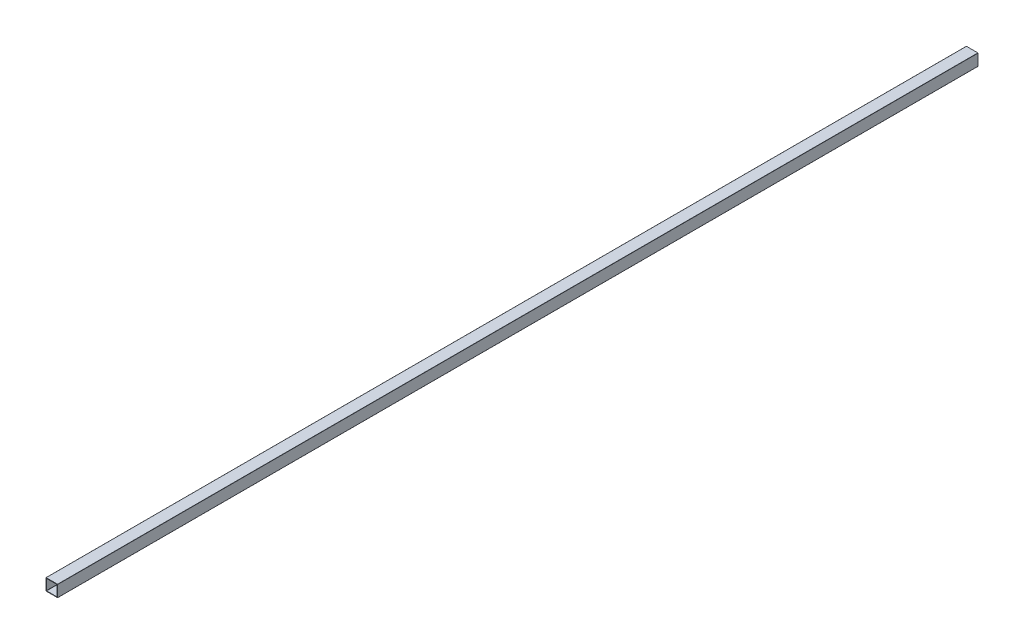
from build123d import *

# Parameters (mm, degrees)
CROQUIS1_W              = 76.2
CROQUIS1_H              = 76.2
CROQUIS1_W_2            = 70.12
CROQUIS1_H_2            = 70.12
SALIENTE_EXTRUIR1_DEPTH = 6000
REDONDEO1_R             = 1


with BuildPart() as part:
    # Croquis1 → Saliente-Extruir1 (new body)
    with BuildSketch(Plane.XY):
        Rectangle(CROQUIS1_W, CROQUIS1_H)
        Rectangle(CROQUIS1_W_2, CROQUIS1_H_2, mode=Mode.SUBTRACT)
    extrude(amount=-SALIENTE_EXTRUIR1_DEPTH)

    # Redondeo1
    redondeo1_edges = [part.edges().sort_by_distance(p)[0] for p in [
        (35.06, -35.06, -3000),
        (-35.06, -35.06, -3000),
        (-35.06, 35.06, -3000),
        (35.06, 35.06, -3000),
        (38.1, -38.1, -3000),
        (-38.1, -38.1, -3000),
        (-38.1, 38.1, -3000),
        (38.1, 38.1, -3000),
    ]]
    fillet(redondeo1_edges, radius=REDONDEO1_R)


solid = part.part
